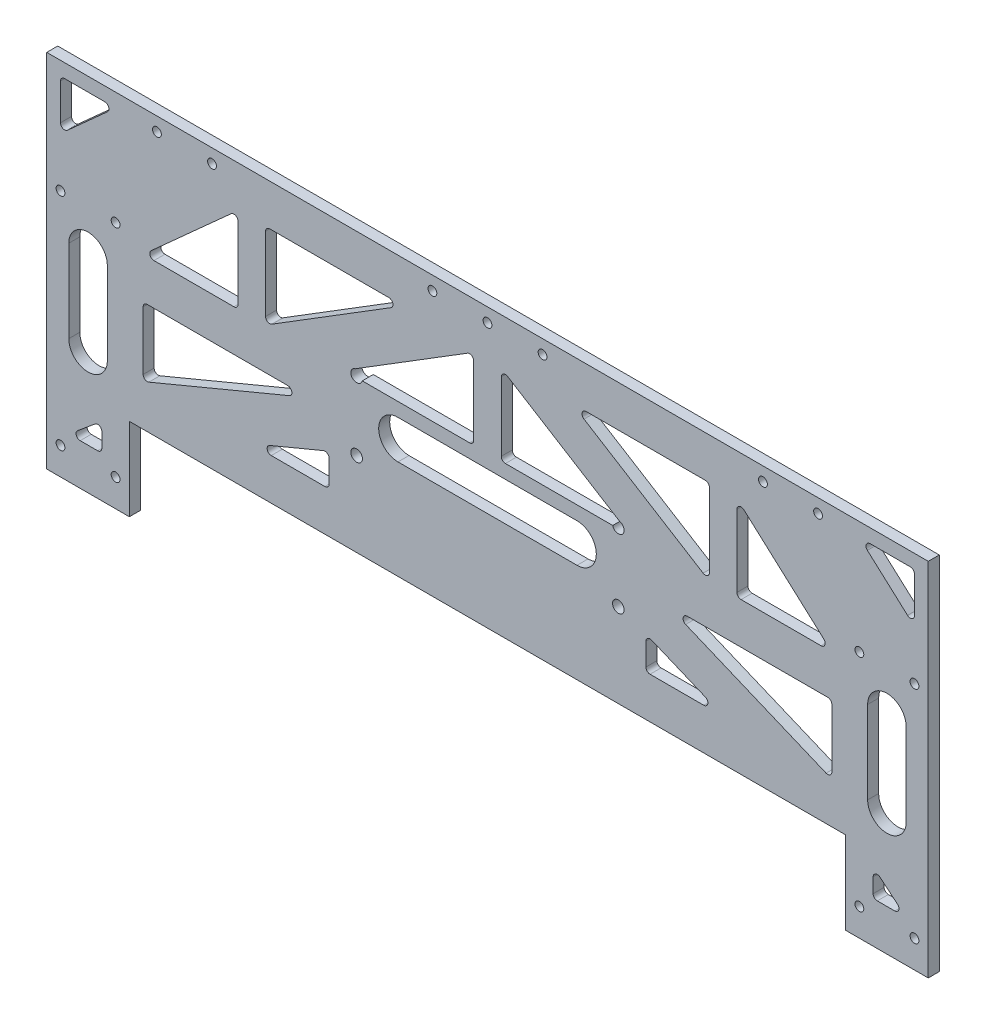
from build123d import *

# Parameters (mm, degrees)
SKETCH_1_W          = 320
SKETCH_1_H          = 131
EXTRUDE_1_DEPTH     = 4
SKETCH_2_W          = 5
SKETCH_2_H          = 30
CUT_EXTRUDE_1_DEPTH = 346.799074608
SKETCH_3_R          = 1.6
CUT_EXTRUDE_2_DEPTH = 346.799074608
SKETCH_4_R          = 1.6
CUT_EXTRUDE_3_DEPTH = 346.799074608
SKETCH_6_R          = 2.1
CUT_EXTRUDE_5_DEPTH = 346.799074608
SKETCH_5_W          = 250
SKETCH_5_H          = 30
CUT_EXTRUDE_4_DEPTH = 346.799074608


with BuildPart() as part:
    # 草图1 → 凸台-拉伸1 (new body)
    with BuildSketch(Plane.XY):
        with Locations((160, 65.5)):
            Rectangle(SKETCH_1_W, SKETCH_1_H)
    extrude(amount=EXTRUDE_1_DEPTH)

    # 草图2 → 切除-拉伸1 (cut, through all)
    with BuildSketch(Plane.XY.offset(4)):
        with Locations((32.5, 15)):
            Rectangle(SKETCH_2_W, SKETCH_2_H)
        with Locations((287.5, 15)):
            Rectangle(SKETCH_2_W, SKETCH_2_H)
    extrude(amount=-CUT_EXTRUDE_1_DEPTH, mode=Mode.SUBTRACT)

    # 草图3 → 切除-拉伸2 (cut, through all)
    with BuildSketch(Plane.XY.offset(4)):
        with Locations((40, 126)):
            Circle(SKETCH_3_R)
        with Locations((60, 126)):
            Circle(SKETCH_3_R)
        with Locations((140, 126)):
            Circle(SKETCH_3_R)
        with Locations((160, 126)):
            Circle(SKETCH_3_R)
        with Locations(Location((260, 126, 0), (0, 0, 180))):
            Circle(SKETCH_3_R)
        with Locations(Location((280, 126, 0), (0, 0, 180))):
            Circle(SKETCH_3_R)
        with Locations(Location((180, 126, 0), (0, 0, 180))):
            Circle(SKETCH_3_R)
    extrude(amount=-CUT_EXTRUDE_2_DEPTH, mode=Mode.SUBTRACT)

    # 草图4 → 切除-拉伸3 (cut, through all)
    with BuildSketch(Plane.XY.offset(4)):
        with Locations((5, 90)):
            Circle(SKETCH_4_R)
        with Locations((25, 90)):
            Circle(SKETCH_4_R)
        with Locations((5, 10)):
            Circle(SKETCH_4_R)
        with Locations((25, 10)):
            Circle(SKETCH_4_R)
        with Locations(Location((295, 10, 0), (0, 0, 180))):
            Circle(SKETCH_4_R)
        with Locations(Location((315, 10, 0), (0, 0, 180))):
            Circle(SKETCH_4_R)
        with Locations(Location((295, 90, 0), (0, 0, 180))):
            Circle(SKETCH_4_R)
        with Locations(Location((315, 90, 0), (0, 0, 180))):
            Circle(SKETCH_4_R)
    extrude(amount=-CUT_EXTRUDE_3_DEPTH, mode=Mode.SUBTRACT)

    # 草图6 → 切除-拉伸5 (cut, through all)
    with BuildSketch(Plane.XY.offset(4)):
        with Locations((112.5, 85.5)):
            Circle(SKETCH_6_R)
        with Locations((207.5, 85.5)):
            Circle(SKETCH_6_R)
        with Locations((207.5, 60.5)):
            Circle(SKETCH_6_R)
        with Locations((112.5, 60.5)):
            Circle(SKETCH_6_R)
        with BuildLine():
            Line((127.5, 80), (192.5, 80))
            ThreePointArc((192.5, 80), (199.5, 73), (192.5, 66))
            Line((192.5, 66), (127.5, 66))
            ThreePointArc((127.5, 66), (120.5, 73), (127.5, 80))
        make_face()
    extrude(amount=-CUT_EXTRUDE_5_DEPTH, mode=Mode.SUBTRACT)

    # 草图5 → 切除-拉伸4 (cut, through all)
    with BuildSketch(Plane.XY.offset(4)):
        with BuildLine():
            Line((5, 111.368043607), (5, 124.5))
            ThreePointArc((5, 124.5), (5.439339828, 125.560660172), (6.5, 126))
            Line((6.5, 126), (21.091062659, 126))
            ThreePointArc((21.091062659, 126), (22.491493276, 125.037395651), (22.094509756, 123.385058781))
            Line((22.094509756, 123.385058781), (7.503447097, 110.253102388))
            ThreePointArc((7.503447097, 110.253102388), (5.889742123, 109.997793512), (5, 111.368043607))
        make_face()
        with BuildLine():
            Line((22, 75), (22, 45))
            ThreePointArc((22, 45), (15, 38), (8, 45))
            Line((8, 45), (8, 75))
            ThreePointArc((8, 75), (15, 82), (22, 75))
        make_face()
        with BuildLine():
            Line((38.908937341, 85), (67.944444444, 85))
            ThreePointArc((67.944444444, 85), (69.005104616, 85.439339828), (69.444444444, 86.5))
            Line((69.444444444, 86.5), (69.444444444, 112.631956393))
            ThreePointArc((69.444444444, 112.631956393), (68.554702322, 114.002206488), (66.940997347, 113.746897612))
            Line((66.940997347, 113.746897612), (37.905490244, 87.614941219))
            ThreePointArc((37.905490244, 87.614941219), (37.508506724, 85.962604349), (38.908937341, 85))
        make_face()
        with BuildLine():
            Line((35, 68.5), (35, 47.25))
            ThreePointArc((35, 47.25), (35.667949706, 46.001924558), (37.076923077, 45.865384615))
            Line((37.076923077, 45.865384615), (88.076923077, 67.115384615))
            ThreePointArc((88.076923077, 67.115384615), (88.970871014, 68.794174203), (87.5, 70))
            Line((87.5, 70), (36.5, 70))
            ThreePointArc((36.5, 70), (35.439339828, 69.560660172), (35, 68.5))
        make_face()
        with Locations((160, 15)):
            Rectangle(SKETCH_5_W, SKETCH_5_H)
        with BuildLine():
            Line((81.5, 45), (101, 45))
            ThreePointArc((101, 45), (102.060660172, 45.439339828), (102.5, 46.5))
            Line((102.5, 46.5), (102.5, 54.625))
            ThreePointArc((102.5, 54.625), (101.832050294, 55.873075442), (100.423076923, 56.009615385))
            Line((100.423076923, 56.009615385), (80.923076923, 47.884615385))
            ThreePointArc((80.923076923, 47.884615385), (80.029128986, 46.205825797), (81.5, 45))
        make_face()
        with BuildLine():
            Line((79.444444444, 87.69490793), (79.444444444, 114.5))
            ThreePointArc((79.444444444, 114.5), (79.883784273, 115.560660172), (80.944444444, 116))
            Line((80.944444444, 116), (124.178463913, 116))
            ThreePointArc((124.178463913, 116), (125.621079776, 114.910925141), (124.968873416, 113.225145962))
            Line((124.968873416, 113.225145962), (81.734853948, 86.420053892))
            ThreePointArc((81.734853948, 86.420053892), (80.214928939, 86.384256516), (79.444444444, 87.69490793))
        make_face()
        with BuildLine():
            Line((113.176681905, 85), (153.5, 85))
            ThreePointArc((153.5, 85), (154.560660172, 85.439339828), (155, 86.5))
            Line((155, 86.5), (155, 111.500457219))
            ThreePointArc((155, 111.500457219), (154.229515505, 112.811108632), (152.709590497, 112.775311256))
            Line((152.709590497, 112.775311256), (112.386272402, 87.774854038))
            ThreePointArc((112.386272402, 87.774854038), (111.734066042, 86.089074859), (113.176681905, 85))
        make_face()
        with BuildLine():
            Line((167.290409503, 112.775311256), (207.613727598, 87.774854038))
            ThreePointArc((207.613727598, 87.774854038), (208.265933958, 86.089074859), (206.823318095, 85))
            Line((206.823318095, 85), (166.5, 85))
            ThreePointArc((166.5, 85), (165.439339828, 85.439339828), (165, 86.5))
            Line((165, 86.5), (165, 111.500457219))
            ThreePointArc((165, 111.500457219), (165.770484495, 112.811108632), (167.290409503, 112.775311256))
        make_face()
        with BuildLine():
            Line((195.031126584, 113.225145962), (238.265146052, 86.420053892))
            ThreePointArc((238.265146052, 86.420053892), (239.785071061, 86.384256516), (240.555555556, 87.69490793))
            Line((240.555555556, 87.69490793), (240.555555556, 114.5))
            ThreePointArc((240.555555556, 114.5), (240.116215727, 115.560660172), (239.055555556, 116))
            Line((239.055555556, 116), (195.821536087, 116))
            ThreePointArc((195.821536087, 116), (194.378920224, 114.910925141), (195.031126584, 113.225145962))
        make_face()
        with BuildLine():
            Line((219.576923077, 56.009615385), (239.076923077, 47.884615385))
            ThreePointArc((239.076923077, 47.884615385), (239.970871014, 46.205825797), (238.5, 45))
            Line((238.5, 45), (219, 45))
            ThreePointArc((219, 45), (217.939339828, 45.439339828), (217.5, 46.5))
            Line((217.5, 46.5), (217.5, 54.625))
            ThreePointArc((217.5, 54.625), (218.167949706, 55.873075442), (219.576923077, 56.009615385))
        make_face()
        with BuildLine():
            Line((232.5, 70), (283.5, 70))
            ThreePointArc((283.5, 70), (284.560660172, 69.560660172), (285, 68.5))
            Line((285, 68.5), (285, 47.25))
            ThreePointArc((285, 47.25), (284.332050294, 46.001924558), (282.923076923, 45.865384615))
            Line((282.923076923, 45.865384615), (231.923076923, 67.115384615))
            ThreePointArc((231.923076923, 67.115384615), (231.029128986, 68.794174203), (232.5, 70))
        make_face()
        with BuildLine():
            Line((253.059002653, 113.746897612), (282.094509756, 87.614941219))
            ThreePointArc((282.094509756, 87.614941219), (282.491493276, 85.962604349), (281.091062659, 85))
            Line((281.091062659, 85), (252.055555556, 85))
            ThreePointArc((252.055555556, 85), (250.994895384, 85.439339828), (250.555555556, 86.5))
            Line((250.555555556, 86.5), (250.555555556, 112.631956393))
            ThreePointArc((250.555555556, 112.631956393), (251.445297678, 114.002206488), (253.059002653, 113.746897612))
        make_face()
        with BuildLine():
            Line((297.905490244, 123.385058781), (312.496552903, 110.253102388))
            ThreePointArc((312.496552903, 110.253102388), (314.110257877, 109.997793512), (315, 111.368043607))
            Line((315, 111.368043607), (315, 124.5))
            ThreePointArc((315, 124.5), (314.560660172, 125.560660172), (313.5, 126))
            Line((313.5, 126), (298.908937341, 126))
            ThreePointArc((298.908937341, 126), (297.508506724, 125.037395651), (297.905490244, 123.385058781))
        make_face()
        with BuildLine():
            Line((298, 75), (298, 45))
            ThreePointArc((298, 45), (305, 38), (312, 45))
            Line((312, 45), (312, 75))
            ThreePointArc((312, 75), (305, 82), (298, 75))
        make_face()
        with BuildLine():
            Line((12.143074903, 15), (18.5, 15))
            ThreePointArc((18.5, 15), (19.560660172, 15.439339828), (20, 16.5))
            Line((20, 16.5), (20, 21.797437581))
            ThreePointArc((20, 21.797437581), (19.136233094, 23.155821713), (17.539723401, 22.9497695))
            Line((17.539723401, 22.9497695), (11.182798303, 17.652331919))
            ThreePointArc((11.182798303, 17.652331919), (10.732667536, 15.989362104), (12.143074903, 15))
        make_face()
        with BuildLine():
            Line((302.460276599, 22.9497695), (308.817201697, 17.652331919))
            ThreePointArc((308.817201697, 17.652331919), (309.267332464, 15.989362104), (307.856925097, 15))
            Line((307.856925097, 15), (301.5, 15))
            ThreePointArc((301.5, 15), (300.439339828, 15.439339828), (300, 16.5))
            Line((300, 16.5), (300, 21.797437581))
            ThreePointArc((300, 21.797437581), (300.863766906, 23.155821713), (302.460276599, 22.9497695))
        make_face()
    extrude(amount=-CUT_EXTRUDE_4_DEPTH, mode=Mode.SUBTRACT)


solid = part.part
